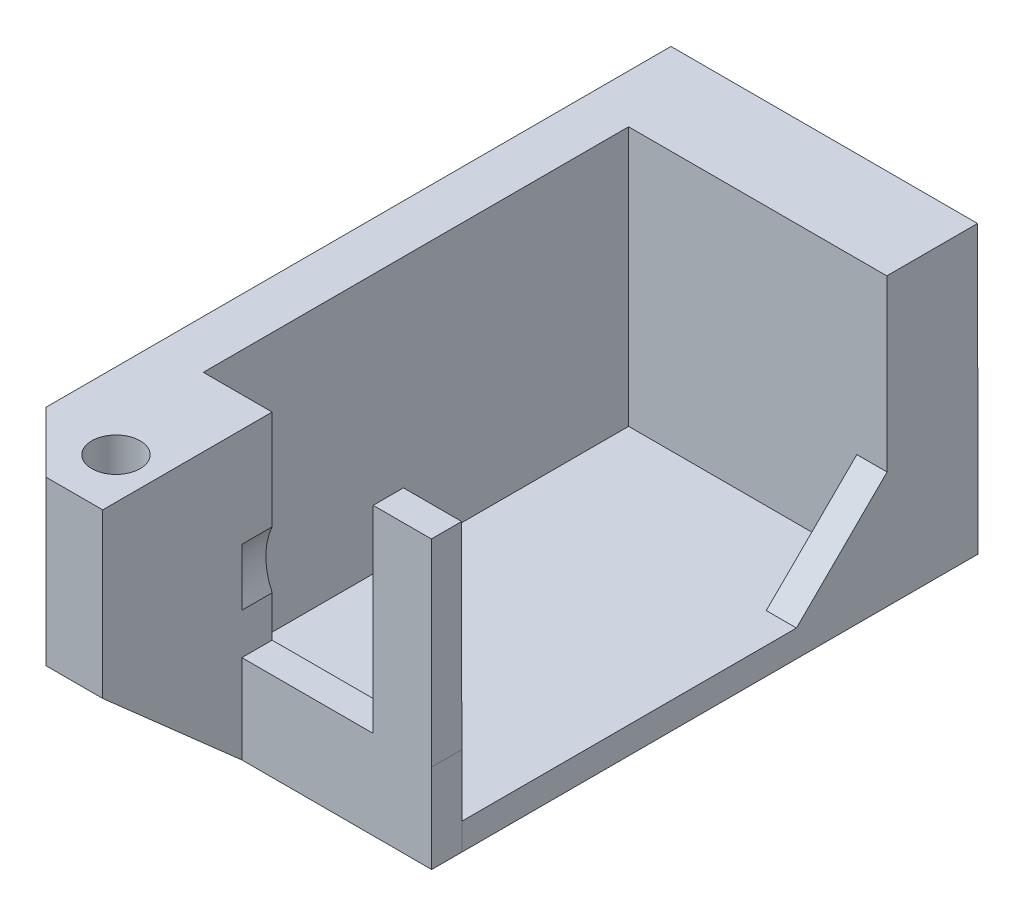
from build123d import *

# Parameters (mm, degrees)
SALIENTE_EXTRUIR1_DEPTH = 5
SALIENTE_EXTRUIR3_DEPTH = 19.374886
CROQUIS3_R              = 3.999935673
CORTAR_EXTRUIR2_DEPTH   = 45
SALIENTE_EXTRUIR4_DEPTH = 85.3
SALIENTE_EXTRUIR5_DEPTH = 15
SALIENTE_EXTRUIR6_DEPTH = 5
CHAFL_N1_SIZE           = 10


with BuildPart() as part:
    # Croquis1 → Saliente-Extruir1 (new body)
    with BuildSketch(Plane.XY):
        with BuildLine():
            Line((-10.200205365, -11.5), (-10.200205365, -4.721731506))
            ThreePointArc((-10.200205365, -4.721731506), (-11.240059515, 0), (-10.200205365, 4.721731506))
            Line((-10.200205365, 4.721731506), (-10.200205365, 21.15))
            Line((-10.200205365, 21.15), (-29.575095614, 21.15))
            Line((-29.575095614, 21.15), (-29.575095614, -26.15))
            Line((-29.575095614, -26.15), (-21.15, -26.15))
            Line((-21.15, -26.15), (21.175474863, -26.15))
            Line((21.175474863, -26.15), (21.15, -11.5))
            Line((21.15, -11.5), (21.124259996, 21.15))
            Line((21.124259996, 21.15), (11.5, 21.15))
            Line((11.5, 21.15), (11.5, -11.5))
            Line((11.5, -11.5), (-10.200205365, -11.5))
        make_face()
    extrude(amount=SALIENTE_EXTRUIR1_DEPTH)

    # Croquis2 → Saliente-Extruir3 (add)
    with BuildSketch(Plane.ZY.offset(29.575095614)):
        Polygon((5, 21.15), (28, 21.15), (28, -5.85), (5, -26.15), align=None)
    extrude(amount=-SALIENTE_EXTRUIR3_DEPTH)

    # Croquis3 → Cortar-Extruir2 (cut)
    with BuildSketch(Plane(origin=(0, 21.15, 0), x_dir=(1, 0, 0), z_dir=(0, 1, 0))):
        with Locations(Location((-17, -19.013114366, 0), (0, 0, 270))):
            Circle(CROQUIS3_R)
    extrude(amount=-CORTAR_EXTRUIR2_DEPTH, mode=Mode.SUBTRACT)

    # Croquis4 → Saliente-Extruir4 (add)
    with BuildSketch(Plane(origin=(0, 0, 0), x_dir=(-1, 0, 0), z_dir=(0, 0, -1))):
        Polygon((-21.175474863, -26.15), (29.575095614, -26.15), (29.575095614, 21.15), (21.575095614, 21.15), (21.575095614, -21.731968458), (-21.168633339, -21.731968458), align=None)
    extrude(amount=SALIENTE_EXTRUIR4_DEPTH)

    # Croquis5 → Saliente-Extruir5 (add)
    with BuildSketch(Plane(origin=(0, 0, -85.3), x_dir=(-1, 0, 0), z_dir=(0, 0, -1))):
        Polygon((-21.168633339, -21.731968458), (-21.102228651, 21.15), (29.575095614, 21.15), (29.575095614, -26.15), (-21.175474863, -26.15), align=None)
    extrude(amount=-SALIENTE_EXTRUIR5_DEPTH)

    # Croquis7 → Saliente-Extruir6 (add)
    with BuildSketch(Plane(origin=(21.134929711, 0.032728405, 0), x_dir=(0, 0, -1), z_dir=(0.9999988010052605, 0.0015485438455565383, 0))):
        Polygon((70.3, -21.764722958), (70.3, -6.93985202), (55.3, -21.764722958), align=None)
    extrude(amount=-SALIENTE_EXTRUIR6_DEPTH)

    # Chaflán1
    chafl_n1_edges = [part.edges().sort_by_distance(p)[0] for p in [
        (-29.575095614, 7.65, 28),
    ]]
    chamfer(chafl_n1_edges, length=CHAFL_N1_SIZE)


solid = part.part
